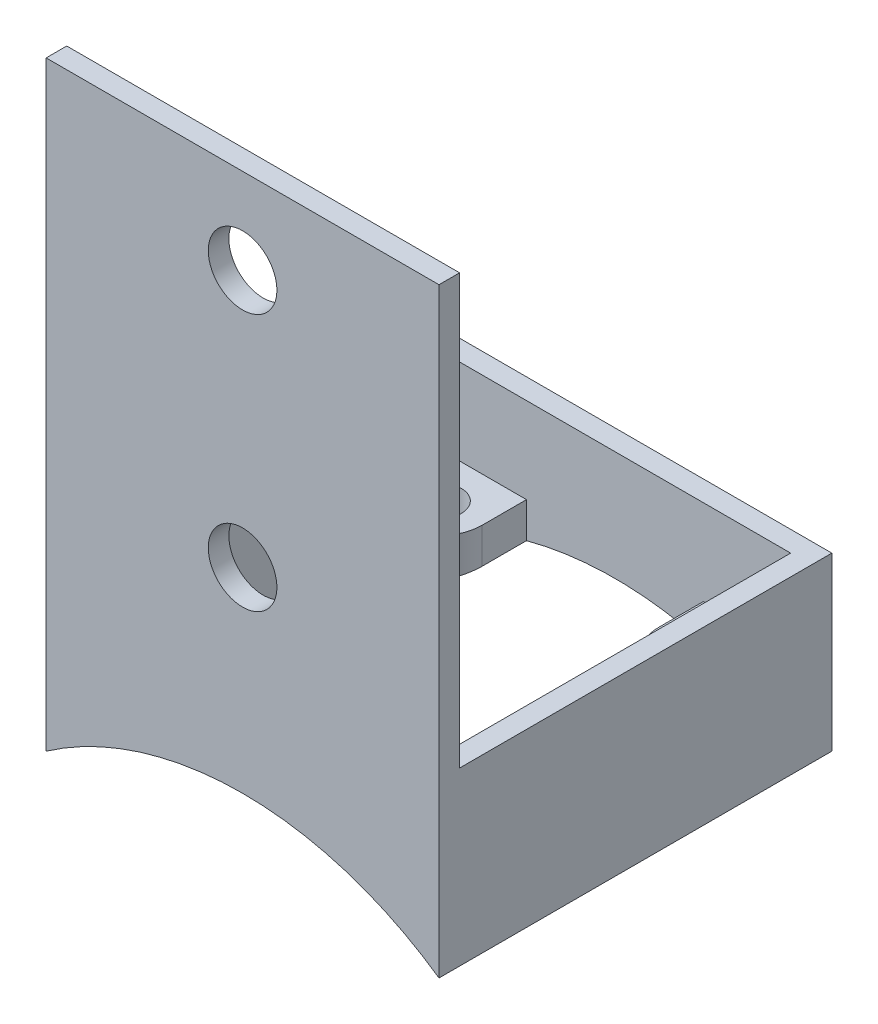
from build123d import *

# Parameters (mm, degrees)
SKETCH_1_W          = 22.9
SKETCH_1_H          = 22.9
SKETCH_1_W_2        = 20.5
SKETCH_1_H_2        = 20.5
EXTRUDE_1_DEPTH     = 10
SKETCH_1_4_R        = 1.27
EXTRUDE_2_DEPTH     = 5
EXTRUDE_3_DEPTH     = 10
SKETCH_3_W          = 22.9
SKETCH_3_H          = 1.2
EXTRUDE_4_DEPTH     = 25
CUT_EXTRUDE_1_REACH = 45.365
SKETCH_4_R          = 20
SKETCH_5_R          = 2
CUT_EXTRUDE_2_DEPTH = 43.743332891


with BuildPart() as part:
    # 草图1 → 凸台-拉伸1 (new body)
    with BuildSketch(Plane(origin=(0, 0, 0), x_dir=(1, 0, 0), z_dir=(0, 1, 0))):
        Rectangle(SKETCH_1_W, SKETCH_1_H)
        Rectangle(SKETCH_1_W_2, SKETCH_1_H_2, mode=Mode.SUBTRACT)
    extrude(amount=EXTRUDE_1_DEPTH)

    # 草图1<4> → 凸台-拉伸2 (add)
    # profile 1 of 2: a face of its own
    with BuildSketch(Plane(origin=(0, 0, 0), x_dir=(1, 0, 0), z_dir=(0, 1, 0))):
        with BuildLine():
            Line((-5.15, 10.25), (-10.25, 10.25))
            Line((-10.25, 10.25), (-10.25, 5.18))
            Line((-10.25, 5.18), (-7.62, 5.18))
            ThreePointArc((-7.62, 5.18), (-5.87344625, 5.90344625), (-5.15, 7.65))
            Line((-5.15, 7.65), (-5.15, 10.25))
        make_face()
        with Locations((-7.62, 7.65)):
            Circle(SKETCH_1_4_R, mode=Mode.SUBTRACT)
    # profile 2 of 2: a face of its own
    with BuildSketch(Plane(origin=(0, 0, 0), x_dir=(1, 0, 0), z_dir=(0, 1, 0))):
        with BuildLine():
            Line((10.25, 10.25), (5.15, 10.25))
            Line((5.15, 10.25), (5.15, 7.65))
            ThreePointArc((5.15, 7.65), (5.87344625, 5.90344625), (7.62, 5.18))
            Line((7.62, 5.18), (10.25, 5.18))
            Line((10.25, 5.18), (10.25, 10.25))
        make_face()
        with Locations((7.62, 7.65)):
            Circle(SKETCH_1_4_R, mode=Mode.SUBTRACT)
    extrude(amount=EXTRUDE_2_DEPTH)

    # 草图1<5> → 凸台-拉伸3 (add)
    with BuildSketch(Plane(origin=(0, 0, 0), x_dir=(1, 0, 0), z_dir=(0, 1, 0))):
        Polygon((10.25, -10.25), (-10.25, -10.25), (-11.45, -10.25), (-11.45, -11.45), (11.45, -11.45), (11.45, -10.25), align=None)
    extrude(amount=EXTRUDE_3_DEPTH)

    # 草图3 → 凸台-拉伸4 (add)
    with BuildSketch(Plane(origin=(0, 10, 0), x_dir=(1, 0, 0), z_dir=(0, 1, 0))):
        with Locations((0, -10.85)):
            Rectangle(SKETCH_3_W, SKETCH_3_H)
    extrude(amount=EXTRUDE_4_DEPTH)

    # 草图4 → 切除-拉伸1 (cut, up to next)
    with BuildSketch(Plane(origin=(0, 0, -11.45), x_dir=(-1, 0, 0), z_dir=(0, 0, -1)), mode=Mode.PRIVATE) as cut_extrude_1_sk1:
        with Locations((0, -16.398094401)):
            Circle(SKETCH_4_R)
    cut_extrude_1_tool1 = extrude(cut_extrude_1_sk1.sketch, amount=-CUT_EXTRUDE_1_REACH, mode=Mode.PRIVATE) & part.part
    add(cut_extrude_1_tool1.solids().sort_by_distance((0, -16.398094, -11.45))[0], mode=Mode.SUBTRACT)

    # 草图5 → 切除-拉伸2 (cut, through all)
    with BuildSketch(Plane(origin=(0, 0, 10.25), x_dir=(-1, 0, 0), z_dir=(0, 0, -1))):
        with Locations((0, 15)):
            Circle(SKETCH_5_R)
        with Locations((0, 30)):
            Circle(SKETCH_5_R)
    extrude(amount=-CUT_EXTRUDE_2_DEPTH, mode=Mode.SUBTRACT)


solid = part.part
